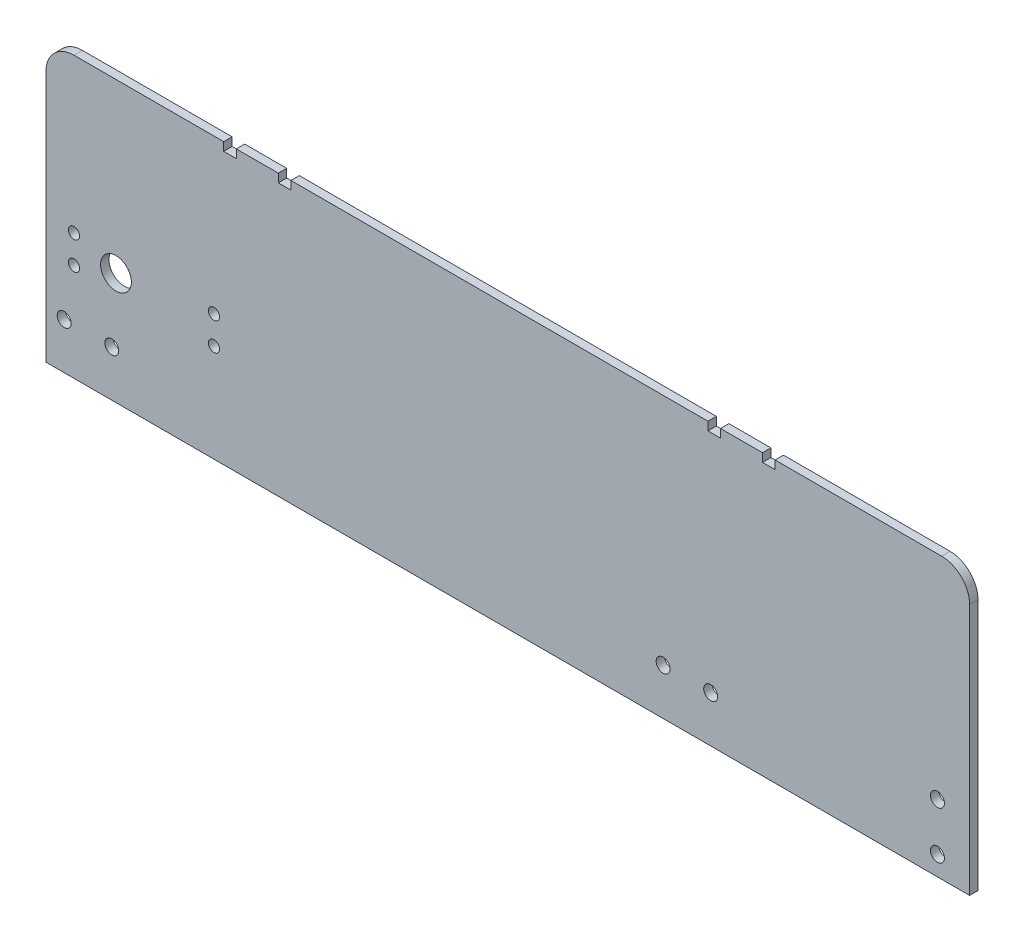
from build123d import *

# Parameters (mm, degrees)
SKETCH_2_R          = 2
SKETCH_2_R_2        = 5.5
SKETCH_2_R_3        = 2.5
EXTRUDE_1_DEPTH     = 1.5
SKETCH_3_R          = 2.5
CUT_EXTRUDE_1_DEPTH = 10
SKETCH_4_W          = 4.5
SKETCH_4_H          = 3
CUT_EXTRUDE_2_DEPTH = 10
SKETCH_5_W          = 4.5
SKETCH_5_H          = 3
CUT_EXTRUDE_3_DEPTH = 10


with BuildPart() as part:
    # 草图2 → 凸台-拉伸1 (new, symmetric)
    with BuildSketch(Plane.XY):
        with BuildLine():
            Line((120, 0), (207, 0))
            Line((207, 0), (208.99932908, 0))
            Line((208.99932908, 0), (330, 0))
            Line((330, 0), (330, 90))
            ThreePointArc((330, 90), (327.071067812, 97.071067812), (320, 100))
            Line((320, 100), (10, 100))
            ThreePointArc((10, 100), (2.928932188, 97.071067812), (0, 90))
            Line((0, 90), (0, 0))
            Line((0, 0), (30, 0))
            Line((30, 0), (120, 0))
        make_face()
        with Locations((10, 45)):
            Circle(SKETCH_2_R, mode=Mode.SUBTRACT)
        with Locations((10, 35)):
            Circle(SKETCH_2_R, mode=Mode.SUBTRACT)
        with Locations((60, 45)):
            Circle(SKETCH_2_R, mode=Mode.SUBTRACT)
        with Locations((60, 35)):
            Circle(SKETCH_2_R, mode=Mode.SUBTRACT)
        with Locations((25, 40)):
            Circle(SKETCH_2_R_2, mode=Mode.SUBTRACT)
        with Locations((6.5, 16.5)):
            Circle(SKETCH_2_R_3, mode=Mode.SUBTRACT)
        with Locations((23.5, 16.5)):
            Circle(SKETCH_2_R_3, mode=Mode.SUBTRACT)
        with Locations((220.5, 16.5)):
            Circle(SKETCH_2_R_3, mode=Mode.SUBTRACT)
        with Locations((237.5, 16.5)):
            Circle(SKETCH_2_R_3, mode=Mode.SUBTRACT)
    extrude(amount=EXTRUDE_1_DEPTH, both=True)

    # 草图3 → 切除-拉伸1 (cut)
    with BuildSketch(Plane.XY.offset(1.5)):
        with Locations((318.5, 24)):
            Circle(SKETCH_3_R)
        with Locations((318.5, 7)):
            Circle(SKETCH_3_R)
    extrude(amount=-CUT_EXTRUDE_1_DEPTH, mode=Mode.SUBTRACT)

    # 草图4 → 切除-拉伸2 (cut)
    with BuildSketch(Plane.XY.offset(1.5)):
        with Locations((65.75, 98.5)):
            Rectangle(SKETCH_4_W, SKETCH_4_H)
        with Locations((258.25, 98.5)):
            Rectangle(SKETCH_4_W, SKETCH_4_H)
    extrude(amount=-CUT_EXTRUDE_2_DEPTH, mode=Mode.SUBTRACT)

    # 草图5 → 切除-拉伸3 (cut)
    with BuildSketch(Plane.XY.offset(1.5)):
        with Locations((85.25, 98.5)):
            Rectangle(SKETCH_5_W, SKETCH_5_H)
        with Locations((238.75, 98.5)):
            Rectangle(SKETCH_5_W, SKETCH_5_H)
    extrude(amount=-CUT_EXTRUDE_3_DEPTH, mode=Mode.SUBTRACT)


solid = part.part
